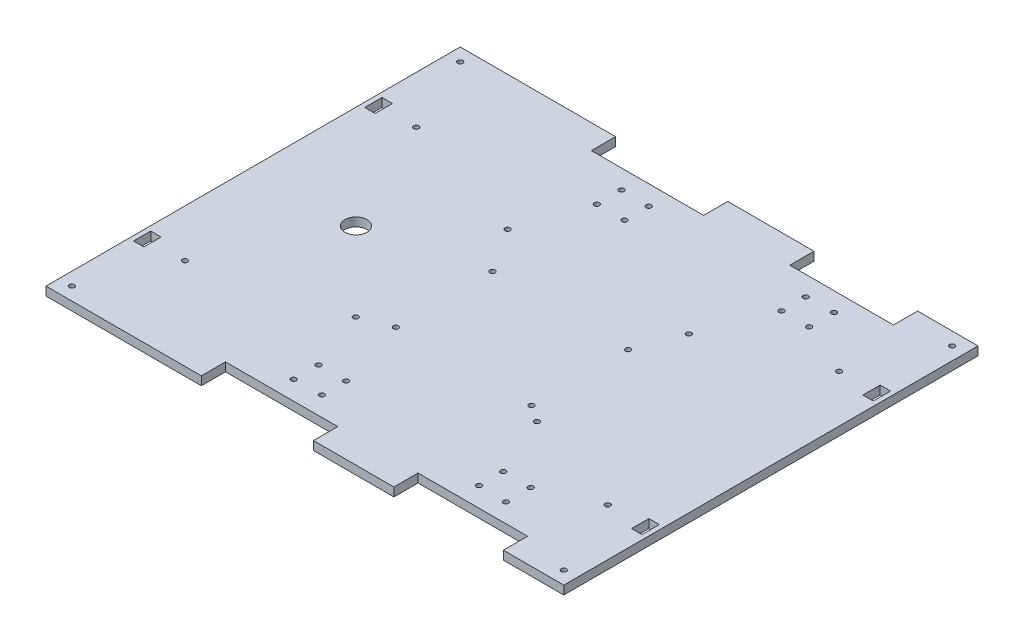
from build123d import *

# Parameters (mm, degrees)
SKETCH2_W                = 300
SKETCH2_H                = 240
BOSS_EXTRUDE1_DEPTH      = 5
SKETCH3_R                = 1.5
CUT_EXTRUDE1_DEPTH       = 193.158788506
MIRROR2_COPY_1_SKETCH_R  = 1.5
MIRROR2_COPY_1_DEPTH     = 193.158788506
SKETCH23_W               = 65
SKETCH23_H               = 14
CUT_EXTRUDE16_DEPTH      = 193.158788506
SKETCH31_W               = 60
SKETCH31_H               = 14
CUT_EXTRUDE17_DEPTH      = 10
SKETCH45_R               = 1.5
CUT_EXTRUDE29_DEPTH      = 193.158788506
SKETCH47_R               = 1.5
CUT_EXTRUDE30_DEPTH      = 193.158788506
SKETCH48_R               = 1.5
CUT_EXTRUDE31_DEPTH      = 193.158788506
SKETCH35_R               = 1.5
CUT_EXTRUDE32_DEPTH      = 193.158788506
SKETCH9_R                = 1.5
CUT_EXTRUDE33_DEPTH      = 193.158788506
SKETCH52_R               = 1.5
CUT_EXTRUDE34_DEPTH      = 193.158788506
SKETCH10_R               = 1.5
SKETCH10_W               = 6
SKETCH10_H               = 10
CUT_EXTRUDE6_DEPTH       = 193.158788506
MIRROR13_COPY_1_SKETCH_R = 1.5
MIRROR13_COPY_1_SKETCH_W = 6
MIRROR13_COPY_1_SKETCH_H = 10
MIRROR13_COPY_1_DEPTH    = 193.158788506
SKETCH55_R               = 1.5
CUT_EXTRUDE35_DEPTH      = 193.158788506
MIRROR25_COPY_1_SKETCH_R = 1.5
MIRROR25_COPY_1_DEPTH    = 193.158788506
SKETCH59_W               = 3.430821158
SKETCH59_H               = 14
CUT_EXTRUDE37_DEPTH      = 193.158788506
SKETCH60_R               = 6.38
CUT_EXTRUDE38_DEPTH      = 193.158788506


with BuildPart() as part:
    # Sketch2 → Boss-Extrude1 (new body)
    with BuildSketch(Plane(origin=(0, 0, 0), x_dir=(1, 0, 0), z_dir=(0, 1, 0))):
        Rectangle(SKETCH2_W, SKETCH2_H)
    extrude(amount=BOSS_EXTRUDE1_DEPTH)

    # Sketch3 → Cut-Extrude1 (cut, through all)
    with BuildSketch(Plane(origin=(0, 5, 0), x_dir=(1, 0, 0), z_dir=(0, 1, 0))):
        with Locations(Location((142.5, 112.5, 0), (0, 0, 270))):
            Circle(SKETCH3_R)
    cut_extrude1 = extrude(amount=-CUT_EXTRUDE1_DEPTH, mode=Mode.SUBTRACT)

    # Mirror1: Cut-Extrude1 across plane
    add(cut_extrude1.mirror(Plane(origin=(0, 0, 0), x_dir=(0, 0, 1), z_dir=(1, 0, 0))), mode=Mode.SUBTRACT)

    # Mirror2: Cut-Extrude1 across plane
    add(cut_extrude1.mirror(Plane.XY), mode=Mode.SUBTRACT)

    # Mirror2 copy 1 sketch → Mirror2 copy 1 (cut, through all)
    with BuildSketch(Plane(origin=(0, 5, 0), x_dir=(-1, 0, 0), z_dir=(0, 1, 0))):
        with Locations(Location((142.5, 112.5, 0), (0, 0, 270))):
            Circle(MIRROR2_COPY_1_SKETCH_R)
    extrude(amount=-MIRROR2_COPY_1_DEPTH, mode=Mode.SUBTRACT)

    # Sketch23 → Cut-Extrude16 (cut, through all)
    with BuildSketch(Plane(origin=(0, 5, 0), x_dir=(1, 0, 0), z_dir=(0, 1, 0))):
        with Locations((-27.5, -113)):
            Rectangle(SKETCH23_W, SKETCH23_H)
    cut_extrude16 = extrude(amount=-CUT_EXTRUDE16_DEPTH, mode=Mode.SUBTRACT)

    # Sketch31 → Cut-Extrude17 (cut)
    with BuildSketch(Plane(origin=(0, 5, 0), x_dir=(1, 0, 0), z_dir=(0, 1, 0))):
        with Locations((85, -113)):
            Rectangle(SKETCH31_W, SKETCH31_H)
    cut_extrude17 = extrude(amount=-CUT_EXTRUDE17_DEPTH, mode=Mode.SUBTRACT)

    # Mirror14: Cut-Extrude16 across plane
    add(cut_extrude16.mirror(Plane.XY), mode=Mode.SUBTRACT)

    # Sketch45 → Cut-Extrude29 (cut, through all)
    with BuildSketch(Plane(origin=(0, 5, 0), x_dir=(1, 0, 0), z_dir=(0, 1, 0))):
        with Locations(Location((-44.788992857, 42.236040749, 0), (0, 0, 270))):
            Circle(SKETCH45_R)
    extrude(amount=-CUT_EXTRUDE29_DEPTH, mode=Mode.SUBTRACT)

    # Sketch47 → Cut-Extrude30 (cut, through all)
    with BuildSketch(Plane(origin=(0, 5, 0), x_dir=(1, 0, 0), z_dir=(0, 1, 0))):
        with Locations(Location((60.211007143, -45.763959251, 0), (0, 0, 270))):
            Circle(SKETCH47_R)
    extrude(amount=-CUT_EXTRUDE30_DEPTH, mode=Mode.SUBTRACT)

    # Sketch48 → Cut-Extrude31 (cut, through all)
    with BuildSketch(Plane(origin=(0, 5, 0), x_dir=(1, 0, 0), z_dir=(0, 1, 0))):
        with Locations(Location((60.211007143, 42.236040749, 0), (0, 0, 270))):
            Circle(SKETCH48_R)
    extrude(amount=-CUT_EXTRUDE31_DEPTH, mode=Mode.SUBTRACT)

    # Sketch35 → Cut-Extrude32 (cut, through all)
    with BuildSketch(Plane(origin=(0, 5, 0), x_dir=(1, 0, 0), z_dir=(0, 1, 0))):
        with Locations(Location((-44.788992857, -45.763959251, 0), (0, 0, 270))):
            Circle(SKETCH35_R)
    extrude(amount=-CUT_EXTRUDE32_DEPTH, mode=Mode.SUBTRACT)

    # Sketch9 → Cut-Extrude33 (cut, through all)
    with BuildSketch(Plane(origin=(0, 0, 0), x_dir=(-1, 0, 0), z_dir=(0, -1, 0))):
        with Locations(Location((28, -39.25, 0), (0, 0, 90))):
            Circle(SKETCH9_R)
    extrude(amount=-CUT_EXTRUDE33_DEPTH, mode=Mode.SUBTRACT)

    # Sketch52 → Cut-Extrude34 (cut, through all)
    with BuildSketch(Plane(origin=(0, 5, 0), x_dir=(1, 0, 0), z_dir=(0, 1, 0))):
        with Locations(Location((-28, 16.75, 0), (0, 0, 270))):
            Circle(SKETCH52_R)
        with Locations(Location((50.5, 16.75, 0), (0, 0, 270))):
            Circle(SKETCH52_R)
        with Locations(Location((50.5, -39.25, 0), (0, 0, 270))):
            Circle(SKETCH52_R)
    extrude(amount=-CUT_EXTRUDE34_DEPTH, mode=Mode.SUBTRACT)

    # Mirror20: Cut-Extrude17 across plane
    add(cut_extrude17.mirror(Plane.XY), mode=Mode.SUBTRACT)

    # Sketch10 → Cut-Extrude6 (cut, through all)
    with BuildSketch(Plane(origin=(0, 5, 0), x_dir=(1, 0, 0), z_dir=(0, 1, 0))):
        with Locations(Location((-122.5, -67, 0), (0, 0, 270))):
            Circle(SKETCH10_R)
        with Locations((-144.3, -67)):
            Rectangle(SKETCH10_W, SKETCH10_H)
    cut_extrude6 = extrude(amount=-CUT_EXTRUDE6_DEPTH, mode=Mode.SUBTRACT)

    # Mirror12: Cut-Extrude6 across plane
    add(cut_extrude6.mirror(Plane.XY), mode=Mode.SUBTRACT)

    # Mirror13: Cut-Extrude6 across plane
    add(cut_extrude6.mirror(Plane(origin=(0, 0, 0), x_dir=(0, 0, 1), z_dir=(1, 0, 0))), mode=Mode.SUBTRACT)

    # Mirror13 copy 1 sketch → Mirror13 copy 1 (cut, through all)
    with BuildSketch(Plane(origin=(0, 5, 0), x_dir=(-1, 0, 0), z_dir=(0, 1, 0))):
        with Locations(Location((-122.5, -67, 0), (0, 0, 270))):
            Circle(MIRROR13_COPY_1_SKETCH_R)
        with Locations((-144.3, -67)):
            Rectangle(MIRROR13_COPY_1_SKETCH_W, MIRROR13_COPY_1_SKETCH_H)
    extrude(amount=-MIRROR13_COPY_1_DEPTH, mode=Mode.SUBTRACT)

    # Sketch55 → Cut-Extrude35 (cut, through all)
    with BuildSketch(Plane(origin=(0, 5, 0), x_dir=(1, 0, 0), z_dir=(0, 1, 0))):
        with Locations(Location((-31.5, -95, 0), (0, 0, 270))):
            Circle(SKETCH55_R)
        with Locations(Location((-15.5, -80.653573709, 0), (0, 0, 270))):
            Circle(SKETCH55_R)
        with Locations(Location((-15.5, -94.653573709, 0), (0, 0, 270))):
            Circle(SKETCH55_R)
        with Locations(Location((-31.5, -80.653573709, 0), (0, 0, 270))):
            Circle(SKETCH55_R)
    cut_extrude35 = extrude(amount=-CUT_EXTRUDE35_DEPTH, mode=Mode.SUBTRACT)

    # Mirror24: Cut-Extrude35 across plane
    add(cut_extrude35.mirror(Plane(origin=(30, 0, 0), x_dir=(0, 0, 1), z_dir=(1, 0, 0))), mode=Mode.SUBTRACT)

    # Mirror25: Cut-Extrude35 across plane
    add(cut_extrude35.mirror(Plane.XY), mode=Mode.SUBTRACT)

    # Mirror25 copy 1 sketch → Mirror25 copy 1 (cut, through all)
    with BuildSketch(Plane(origin=(60, 5, 0), x_dir=(-1, 0, 0), z_dir=(0, 1, 0))):
        with Locations(Location((-31.5, -95, 0), (0, 0, 270))):
            Circle(MIRROR25_COPY_1_SKETCH_R)
        with Locations(Location((-15.5, -80.653573709, 0), (0, 0, 270))):
            Circle(MIRROR25_COPY_1_SKETCH_R)
        with Locations(Location((-15.5, -94.653573709, 0), (0, 0, 270))):
            Circle(MIRROR25_COPY_1_SKETCH_R)
        with Locations(Location((-31.5, -80.653573709, 0), (0, 0, 270))):
            Circle(MIRROR25_COPY_1_SKETCH_R)
    extrude(amount=-MIRROR25_COPY_1_DEPTH, mode=Mode.SUBTRACT)

    # Sketch59 → Cut-Extrude37 (cut, through all)
    with BuildSketch(Plane(origin=(0, 5, 0), x_dir=(1, 0, 0), z_dir=(0, 1, 0))):
        with Locations((53.284589421, -113)):
            Rectangle(SKETCH59_W, SKETCH59_H)
    extrude(amount=-CUT_EXTRUDE37_DEPTH, mode=Mode.SUBTRACT)

    # Sketch60 → Cut-Extrude38 (cut, through all)
    with BuildSketch(Plane(origin=(0, 5, 0), x_dir=(1, 0, 0), z_dir=(0, 1, 0))):
        with Locations(Location((-90.412183362, 0, 0), (0, 0, 270))):
            Circle(SKETCH60_R)
    extrude(amount=-CUT_EXTRUDE38_DEPTH, mode=Mode.SUBTRACT)


solid = part.part
